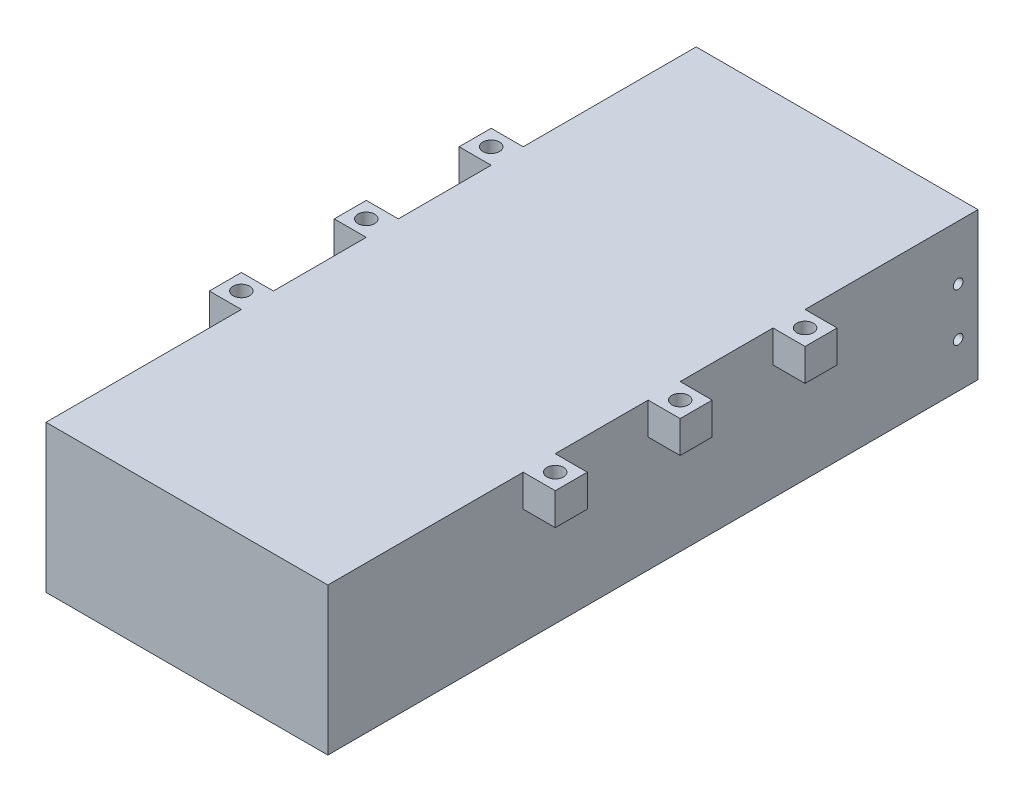
from build123d import *

# Parameters (mm, degrees)
SKETCH1_W           = 88
SKETCH1_H           = 46
SKETCH1_W_2         = 82
SKETCH1_H_2         = 40
BOSS_EXTRUDE1_DEPTH = 3
SKETCH3_W           = 88
SKETCH3_H           = 46
BOSS_EXTRUDE2_DEPTH = 200
SKETCH4_W           = 10
SKETCH4_H           = 10
BOSS_EXTRUDE3_DEPTH = 10
SKETCH7_R           = 2.6
CUT_EXTRUDE1_DEPTH  = 228.420315715
SKETCH8_W           = 3
SKETCH8_H           = 5
BOSS_EXTRUDE4_DEPTH = 8
FILLET1_RADIUS      = 2.5
FILLET1_LENGTH      = 3
SKETCH10_R          = 1.5
CUT_EXTRUDE3_DEPTH  = 10
SKETCH9_R           = 1.5
CUT_EXTRUDE4_DEPTH  = 10


with BuildPart() as part:
    # Sketch1 → Boss-Extrude1 (new body)
    # profile 1 of 2: a face of its own
    with BuildSketch(Plane.XY):
        with Locations((-44, -23)):
            Rectangle(SKETCH1_W, SKETCH1_H)
        with Locations((-44, -23)):
            Rectangle(SKETCH1_W_2, SKETCH1_H_2, mode=Mode.SUBTRACT)
    # profile 2 of 2: a face of its own
    with BuildSketch(Plane.XY):
        with Locations((-44, -23)):
            Rectangle(SKETCH1_W_2, SKETCH1_H_2)
    extrude(amount=BOSS_EXTRUDE1_DEPTH)

    # Sketch3 → Boss-Extrude2 (add)
    with BuildSketch(Plane(origin=(0, 0, 0), x_dir=(-1, 0, 0), z_dir=(0, 0, -1))):
        with Locations((44, -23)):
            Rectangle(SKETCH3_W, SKETCH3_H)
        Polygon((24, -3), (43, -3), (43, -1.5), (45, -1.5), (45, -3), (64, -3), (64, -1.5), (66, -1.5), (66, -3), (85, -3), (85, -43), (66, -43), (66, -44.5), (64, -44.5), (64, -43), (45, -43), (45, -44.5), (43, -44.5), (43, -43), (24, -43), (24, -44.5), (22, -44.5), (22, -43), (3, -43), (3, -3), (22, -3), (22, -1.5), (24, -1.5), align=None, mode=Mode.SUBTRACT)
    extrude(amount=BOSS_EXTRUDE2_DEPTH)

    # Sketch4 → Boss-Extrude3 (add)
    with BuildSketch(Plane(origin=(0, 0, 0), x_dir=(1, 0, 0), z_dir=(0, 1, 0))):
        with Locations((5, 141)):
            Rectangle(SKETCH4_W, SKETCH4_H)
        with Locations((5, 102)):
            Rectangle(SKETCH4_W, SKETCH4_H)
        with Locations((5, 63)):
            Rectangle(SKETCH4_W, SKETCH4_H)
        with Locations((-93, 141)):
            Rectangle(SKETCH4_W, SKETCH4_H)
        with Locations((-93, 102)):
            Rectangle(SKETCH4_W, SKETCH4_H)
        with Locations((-93, 63)):
            Rectangle(SKETCH4_W, SKETCH4_H)
    extrude(amount=-BOSS_EXTRUDE3_DEPTH)

    # Sketch7 → Cut-Extrude1 (cut, through all)
    with BuildSketch(Plane(origin=(0, 0, 0), x_dir=(1, 0, 0), z_dir=(0, 1, 0))):
        with Locations(Location((-93, 141, 0), (0, 0, 270))):
            Circle(SKETCH7_R)
        with Locations(Location((-93, 102, 0), (0, 0, 270))):
            Circle(SKETCH7_R)
        with Locations(Location((-93, 63, 0), (0, 0, 270))):
            Circle(SKETCH7_R)
        with Locations(Location((5, 141, 0), (0, 0, 270))):
            Circle(SKETCH7_R)
        with Locations(Location((5, 102, 0), (0, 0, 270))):
            Circle(SKETCH7_R)
        with Locations(Location((5, 63, 0), (0, 0, 270))):
            Circle(SKETCH7_R)
    extrude(amount=-CUT_EXTRUDE1_DEPTH, mode=Mode.SUBTRACT)

    # Sketch8 → Boss-Extrude4 (add)
    with BuildSketch(Plane(origin=(0, 0, -200), x_dir=(-1, 0, 0), z_dir=(0, 0, -1))):
        with Locations((86.5, -23)):
            Rectangle(SKETCH8_W, SKETCH8_H)
    extrude(amount=BOSS_EXTRUDE4_DEPTH)

    # Fillet1: full round fillet: the end face becomes a half cylinder, R = half its width
    fillet1_face = Plane((-86.5, -23, -208), x_dir=(-1, 0, 0), z_dir=(0, 0, -1))  # on the end face: x along it, z out of the body
    fillet1_slab = fillet1_face.offset(-FILLET1_RADIUS / 2) * Box(FILLET1_LENGTH, 2 * FILLET1_RADIUS, FILLET1_RADIUS, mode=Mode.PRIVATE)  # the body's end, R deep
    fillet1_round = Plane((-86.5, -23, -205.5), x_dir=(0, 0, -1), z_dir=(-1, 0, 0)) * Cylinder(FILLET1_RADIUS, FILLET1_LENGTH, mode=Mode.PRIVATE)  # its axis R under the face
    add(fillet1_slab - fillet1_round, mode=Mode.SUBTRACT)

    # Sketch10 → Cut-Extrude3 (cut)
    with BuildSketch(Plane(origin=(0, 0, 0), x_dir=(0, 0, -1), z_dir=(1, 0, 0))):
        with Locations(Location((193.8, -32, 0), (0, 0, 90))):
            Circle(SKETCH10_R)
        with Locations(Location((193.8, -17, 0), (0, 0, 90))):
            Circle(SKETCH10_R)
    extrude(amount=-CUT_EXTRUDE3_DEPTH, mode=Mode.SUBTRACT)

    # Sketch9 → Cut-Extrude4 (cut)
    with BuildSketch(Plane.ZY.offset(88)):
        with Locations((-205.5, -23)):
            Circle(SKETCH9_R)
    extrude(amount=-CUT_EXTRUDE4_DEPTH, mode=Mode.SUBTRACT)


solid = part.part
